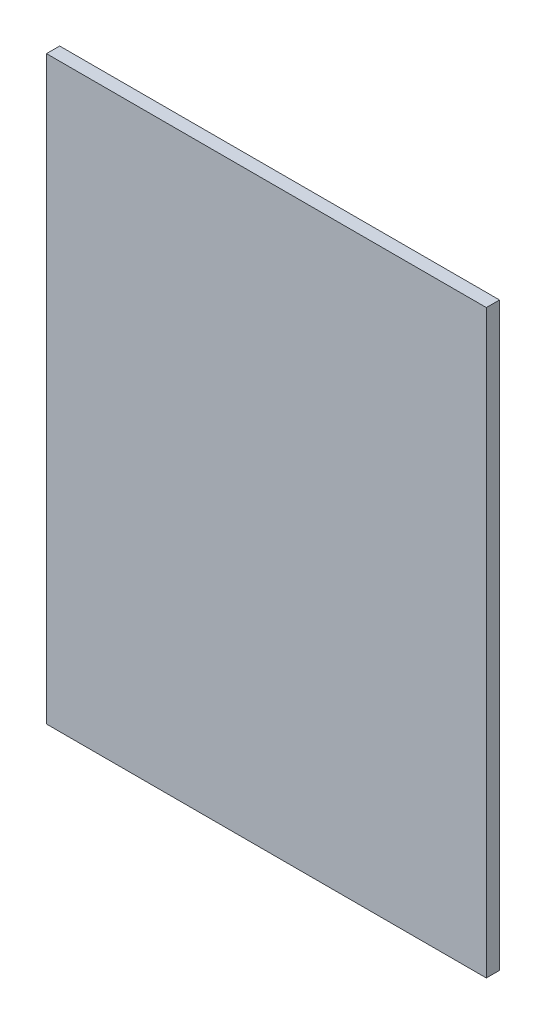
from build123d import *

# Parameters (mm, degrees)
SKETCH1_W           = 600
SKETCH1_H           = 792
BOSS_EXTRUDE1_DEPTH = 18


with BuildPart() as part:
    # Sketch1 → Boss-Extrude1 (new body)
    with BuildSketch(Plane.XY):
        with Locations((300, 396)):
            Rectangle(SKETCH1_W, SKETCH1_H)
    extrude(amount=BOSS_EXTRUDE1_DEPTH)


solid = part.part
